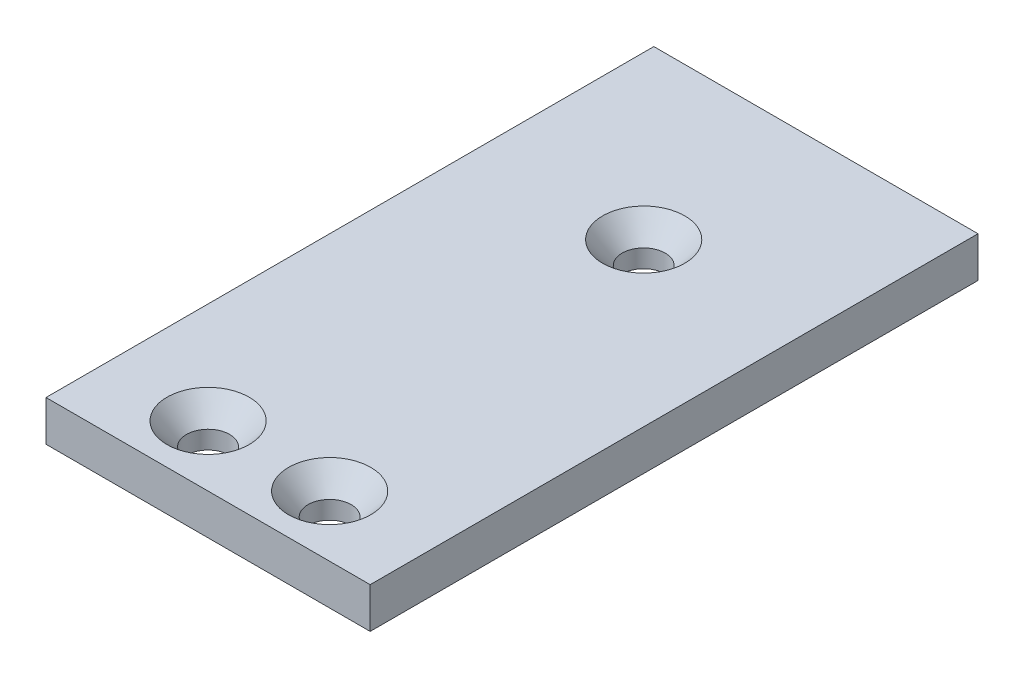
from build123d import *

# Parameters (mm, degrees)
SKETCH1_W                                     = 50.8
SKETCH1_H                                     = 95.25
BOSS_EXTRUDE1_DEPTH                           = 6.35
CSK_FOR_1_4_FLAT_HEAD_MACHINE_SCREW1_AT_COUNT = 2
CSK_FOR_1_4_FLAT_HEAD_MACHINE_SCREW1_AT_PITCH = 59.504785784
CSK_FOR_1_4_FLAT_HEAD_MACHINE_SCREW1_2_COUNT  = 2
CSK_FOR_1_4_FLAT_HEAD_MACHINE_SCREW1_2_PITCH  = 59.504785784


with BuildPart() as part:
    # Sketch1 → Boss-Extrude1 (new body)
    with BuildSketch(Plane(origin=(0, 0, 0), x_dir=(1, 0, 0), z_dir=(0, 1, 0))):
        with Locations((25.4, 47.625)):
            Rectangle(SKETCH1_W, SKETCH1_H)
    extrude(amount=BOSS_EXTRUDE1_DEPTH)

    # Sketch4 → CSK for 1/4 Flat Head Machine Screw1 (revolve, cut)
    with BuildSketch(Plane(origin=(25.4, 6.35, -68.2625), x_dir=(0, 0, 1), z_dir=(1, 0, 0))):
        Polygon((0, 0), (0, 6.35), (3.3782, 6.35), (3.3782, 3.520932584), (6.4389, 0), align=None)
    csk_for_1_4_flat_head_machine_screw1 = revolve(axis=Axis((25.4, 12.7, -68.2625), (0, -1, 0)), mode=Mode.SUBTRACT)

    # CSK for 1/4 Flat Head Machine Screw1 at: CSK for 1/4 Flat Head Machine Screw1 ×2
    with Locations(*[Vector(-0.16007115855366244, 0, 0.9871054777475852) * (i * CSK_FOR_1_4_FLAT_HEAD_MACHINE_SCREW1_AT_PITCH) for i in range(1, CSK_FOR_1_4_FLAT_HEAD_MACHINE_SCREW1_AT_COUNT)]):
        add(csk_for_1_4_flat_head_machine_screw1, mode=Mode.SUBTRACT)

    # CSK for 1_4 Flat Head Machine Screw1 2: CSK for 1/4 Flat Head Machine Screw1 ×2
    with Locations(*[Vector(0.16007115855366244, 0, 0.9871054777475852) * (i * CSK_FOR_1_4_FLAT_HEAD_MACHINE_SCREW1_2_PITCH) for i in range(1, CSK_FOR_1_4_FLAT_HEAD_MACHINE_SCREW1_2_COUNT)]):
        add(csk_for_1_4_flat_head_machine_screw1, mode=Mode.SUBTRACT)


solid = part.part
